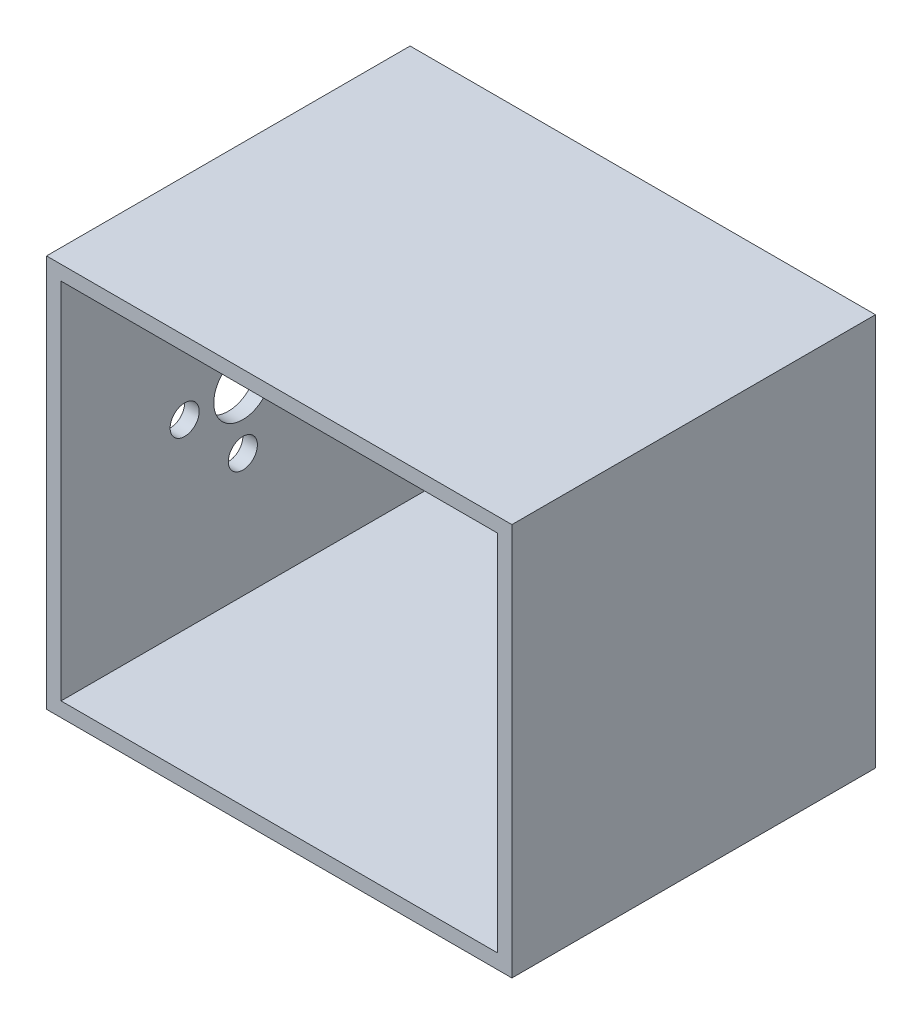
from build123d import *

# Parameters (mm, degrees)
IZIM1_W               = 64
IZIM1_H               = 54
IZIM1_W_2             = 60
IZIM1_H_2             = 50
EKSTR_ZYON_NCE1_DEPTH = 50
KES_EKSTR_ZYON1_REACH = 98.437
IZIM2_R               = 4
IZIM2_R_2             = 2


with BuildPart() as part:
    # Çizim1 → Ekstrüzyon-İnce1 (new body)
    with BuildSketch(Plane.XY):
        with Locations((30, 25)):
            Rectangle(IZIM1_W, IZIM1_H)
        with Locations((30, 25)):
            Rectangle(IZIM1_W_2, IZIM1_H_2, mode=Mode.SUBTRACT)
    extrude(amount=EKSTR_ZYON_NCE1_DEPTH)

    # Çizim2 → Kes-Ekstrüzyon1 (cut, up to next)
    with BuildSketch(Plane.ZY.offset(2), mode=Mode.PRIVATE) as kes_ekstr_zyon1_sk1:
        with Locations((25, 25)):
            Circle(IZIM2_R)
    kes_ekstr_zyon1_tool1 = extrude(kes_ekstr_zyon1_sk1.sketch, amount=-KES_EKSTR_ZYON1_REACH, mode=Mode.PRIVATE) & part.part
    # Çizim2 → Kes-Ekstrüzyon1 (cut, up to next)
    with BuildSketch(Plane.ZY.offset(2), mode=Mode.PRIVATE) as kes_ekstr_zyon1_sk2:
        with Locations((33, 25)):
            Circle(IZIM2_R_2)
    kes_ekstr_zyon1_tool2 = extrude(kes_ekstr_zyon1_sk2.sketch, amount=-KES_EKSTR_ZYON1_REACH, mode=Mode.PRIVATE) & part.part
    # Çizim2 → Kes-Ekstrüzyon1 (cut, up to next)
    with BuildSketch(Plane.ZY.offset(2), mode=Mode.PRIVATE) as kes_ekstr_zyon1_sk3:
        with Locations(Location((17, 25, 0), (0, 0, 180))):
            Circle(IZIM2_R_2)
    kes_ekstr_zyon1_tool3 = extrude(kes_ekstr_zyon1_sk3.sketch, amount=-KES_EKSTR_ZYON1_REACH, mode=Mode.PRIVATE) & part.part
    # Çizim2 → Kes-Ekstrüzyon1 (cut, up to next)
    with BuildSketch(Plane.ZY.offset(2), mode=Mode.PRIVATE) as kes_ekstr_zyon1_sk4:
        with Locations((25, 33)):
            Circle(IZIM2_R_2)
    kes_ekstr_zyon1_tool4 = extrude(kes_ekstr_zyon1_sk4.sketch, amount=-KES_EKSTR_ZYON1_REACH, mode=Mode.PRIVATE) & part.part
    # Çizim2 → Kes-Ekstrüzyon1 (cut, up to next)
    with BuildSketch(Plane.ZY.offset(2), mode=Mode.PRIVATE) as kes_ekstr_zyon1_sk5:
        with Locations(Location((25, 17, 0), (0, 0, 180))):
            Circle(IZIM2_R_2)
    kes_ekstr_zyon1_tool5 = extrude(kes_ekstr_zyon1_sk5.sketch, amount=-KES_EKSTR_ZYON1_REACH, mode=Mode.PRIVATE) & part.part
    add(kes_ekstr_zyon1_tool1.solids().sort_by_distance((-2, 25, 25))[0], mode=Mode.SUBTRACT)
    add(kes_ekstr_zyon1_tool2.solids().sort_by_distance((-2, 25, 33))[0], mode=Mode.SUBTRACT)
    add(kes_ekstr_zyon1_tool3.solids().sort_by_distance((-2, 25, 17))[0], mode=Mode.SUBTRACT)
    add(kes_ekstr_zyon1_tool4.solids().sort_by_distance((-2, 33, 25))[0], mode=Mode.SUBTRACT)
    add(kes_ekstr_zyon1_tool5.solids().sort_by_distance((-2, 17, 25))[0], mode=Mode.SUBTRACT)


solid = part.part
